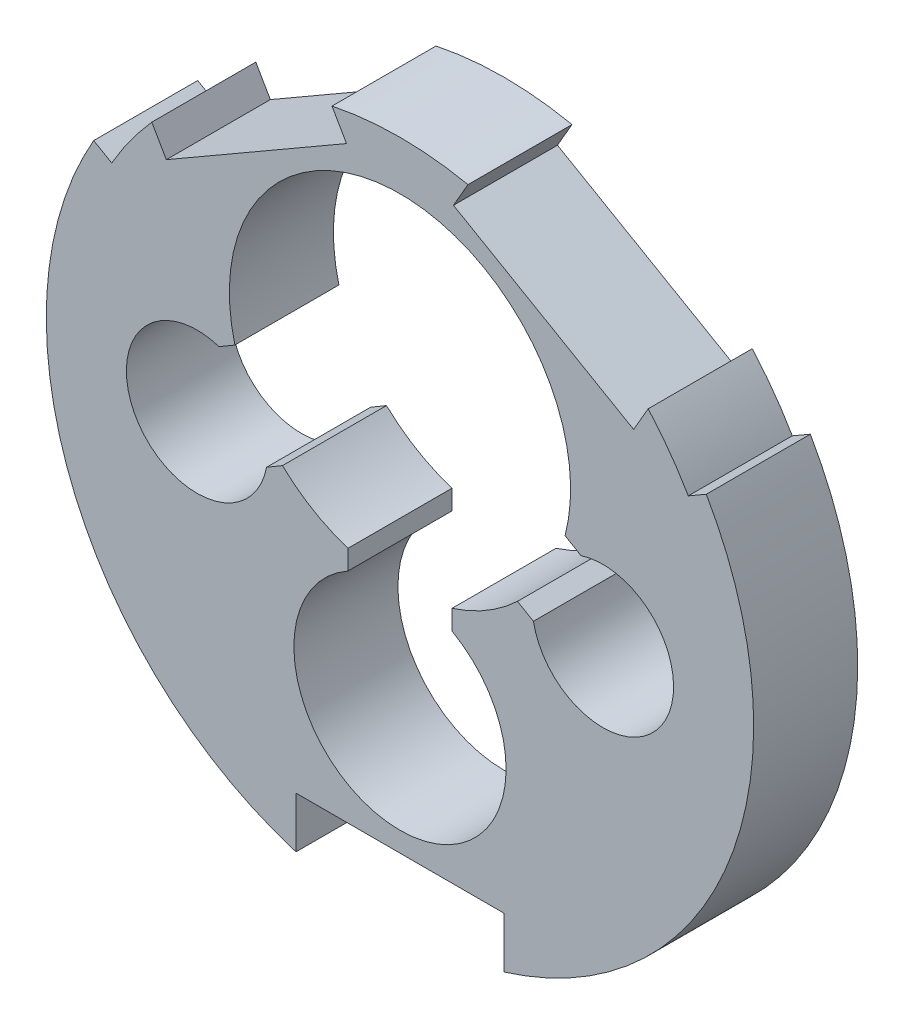
from build123d import *

# Parameters (mm, degrees)
EXTRUDE_1_DEPTH     = 2.5
BOSS_EXTRUDE3_START = -2.5
BOSS_EXTRUDE3_DEPTH = 5


with BuildPart() as part:
    # Эскиз1 → Бобышка-Вытянуть1 (new, symmetric)
    with BuildSketch(Plane.XY):
        with BuildLine():
            Line((3.269215058, 15.662446581), (2.569872981, 14.451150572))
            Line((2.569872981, 14.451150572), (11.230127019, 9.451150572))
            Line((11.230127019, 9.451150572), (11.929469096, 10.662446581))
            ThreePointArc((11.929469096, 10.662446581), (15.454813221, -4.141104722), (5, -15.198684154))
            Line((5, -15.198684154), (5, -13.8))
            Line((5, -13.8), (0, -13.8))
            Line((0, -13.8), (-5, -13.8))
            Line((-5, -13.8), (-5, -15.198684154))
            ThreePointArc((-5, -15.198684154), (-15.454813221, -4.141104722), (-11.929469096, 10.662446581))
            Line((-11.929469096, 10.662446581), (-11.230127019, 9.451150572))
            Line((-11.230127019, 9.451150572), (-2.569872981, 14.451150572))
            Line((-2.569872981, 14.451150572), (-3.269215058, 15.662446581))
            ThreePointArc((-3.269215058, 15.662446581), (0, 16), (3.269215058, 15.662446581))
        make_face()
        with BuildLine():
            Line((-2.5, -2.359609465), (-2.5, -3.304777846))
            ThreePointArc((-2.5, -3.304777846), (0, -12.85), (2.5, -3.304777846))
            Line((2.5, -3.304777846), (2.5, -2.359609465))
            ThreePointArc((2.5, -2.359609465), (4.180016715, -1.604605606), (5.649137352, -0.493672869))
            Line((5.649137352, -0.493672869), (6.41139529, -0.943209602))
            ThreePointArc((6.41139529, -0.943209602), (12.678644072, -2.027149068), (8.69732788, 2.932936963))
            Line((8.69732788, 2.932936963), (7.935069942, 3.382473696))
            ThreePointArc((7.935069942, 3.382473696), (0, 13.65), (-7.935069942, 3.382473696))
            Line((-7.935069942, 3.382473696), (-8.69732788, 2.932936963))
            ThreePointArc((-8.69732788, 2.932936963), (-12.678644072, -2.027149068), (-6.41139529, -0.943209602))
            Line((-6.41139529, -0.943209602), (-5.649137352, -0.493672869))
            ThreePointArc((-5.649137352, -0.493672869), (-4.180016715, -1.604605606), (-2.5, -2.359609465))
        make_face(mode=Mode.SUBTRACT)
    extrude(amount=EXTRUDE_1_DEPTH, both=True)

    # Sketch2 → Boss-Extrude3 (add)
    with BuildSketch(Plane.XY.offset(BOSS_EXTRUDE3_START)):
        with BuildLine():
            ThreePointArc((-5, -15.198684154), (-14.947767484, -5.706509199), (-13.856406461, 8))
            Line((-13.856406461, 8), (-14.722431864, 8.5))
            ThreePointArc((-14.722431864, 8.5), (-15.822781238, -6.216075442), (-5, -16.248076809))
            Line((-5, -16.248076809), (-5, -15.198684154))
        make_face()
        with BuildLine():
            Line((14.722431864, 8.5), (13.856406461, 8))
            ThreePointArc((13.856406461, 8), (14.947767484, -5.706509199), (5, -15.198684154))
            Line((5, -15.198684154), (5, -16.248076809))
            ThreePointArc((5, -16.248076809), (15.822781238, -6.216075442), (14.722431864, 8.5))
        make_face()
    extrude(amount=BOSS_EXTRUDE3_DEPTH)


solid = part.part
